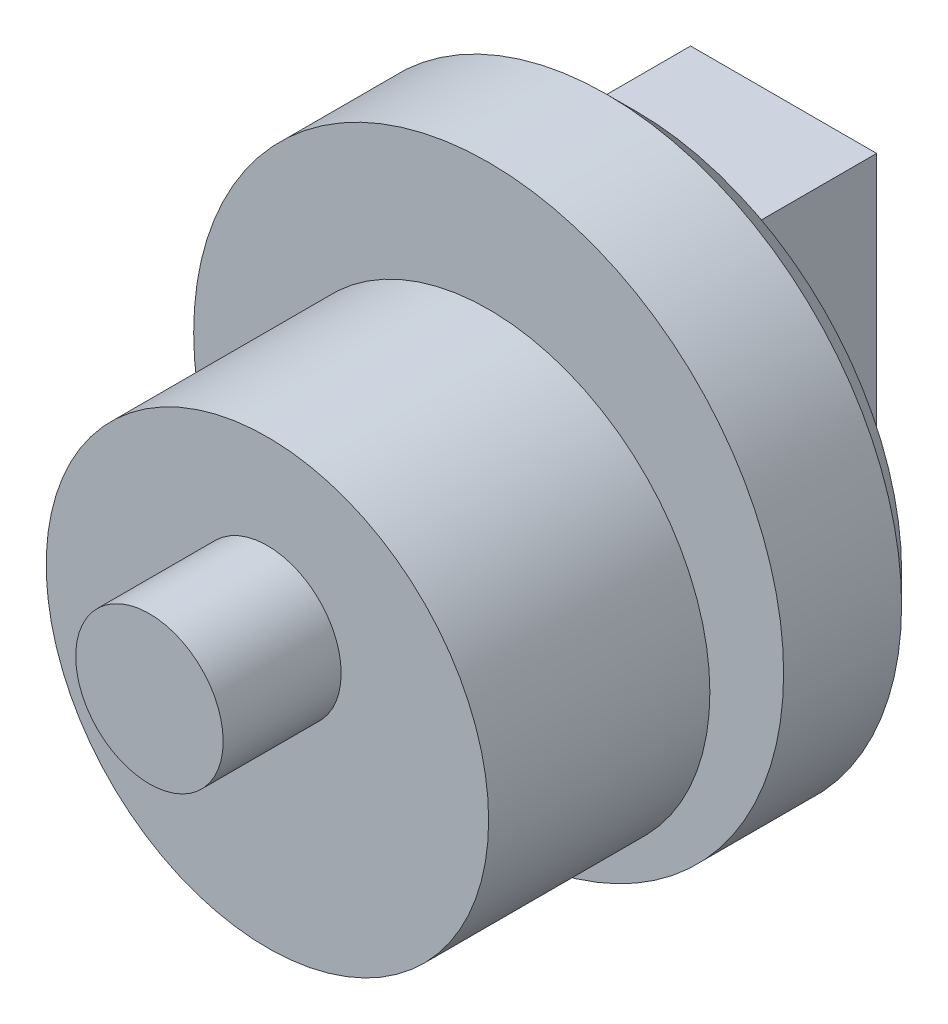
from build123d import *

# Parameters (mm, degrees)
SKETCH1_R           = 10
BOSS_EXTRUDE1_DEPTH = 5
SKETCH2_R           = 7.5
BOSS_EXTRUDE2_DEPTH = 7.5
SKETCH3_R           = 2.5
BOSS_EXTRUDE3_DEPTH = 4
SKETCH4_W           = 6.306649828
SKETCH4_H           = 13.679653114
BOSS_EXTRUDE4_DEPTH = 5
CHAMFER2_SIZE       = 1


with BuildPart() as part:
    # Sketch1 → Boss-Extrude1 (new body)
    with BuildSketch(Plane.XY):
        Circle(SKETCH1_R)
    extrude(amount=BOSS_EXTRUDE1_DEPTH)

    # Sketch2 → Boss-Extrude2 (add)
    with BuildSketch(Plane.XY.offset(5)):
        with Locations((0, -1.812)):
            Circle(SKETCH2_R)
    extrude(amount=BOSS_EXTRUDE2_DEPTH)

    # Sketch3 → Boss-Extrude3 (add)
    with BuildSketch(Plane.XY.offset(12.5)):
        Circle(SKETCH3_R)
    extrude(amount=BOSS_EXTRUDE3_DEPTH)

    # Sketch4 → Boss-Extrude4 (add)
    with BuildSketch(Plane(origin=(0, 0, 0), x_dir=(-1, 0, 0), z_dir=(0, 0, -1))):
        Rectangle(SKETCH4_W, SKETCH4_H)
    extrude(amount=BOSS_EXTRUDE4_DEPTH)

    # Chamfer2
    chamfer2_edges = [part.edges().sort_by_distance(p)[0] for p in [
        (-10, 0, 0),
    ]]
    chamfer(chamfer2_edges, length=CHAMFER2_SIZE)


solid = part.part
